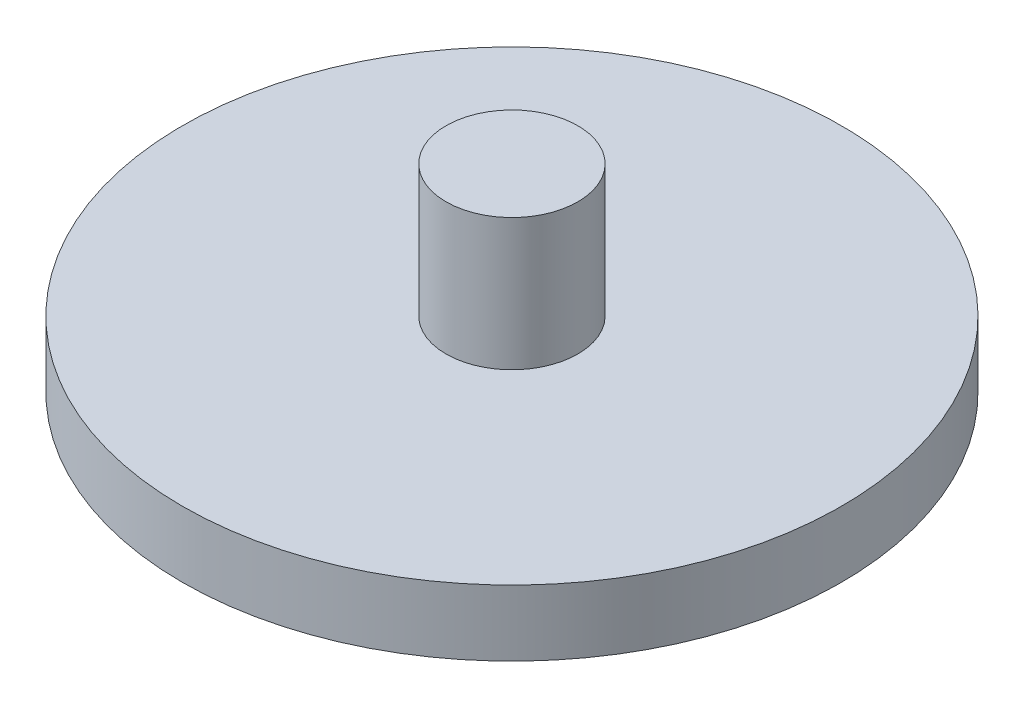
from build123d import *

# Parameters (mm, degrees)
SKETCH2_R           = 50
BOSS_EXTRUDE1_DEPTH = 10
SKETCH3_R           = 10
BOSS_EXTRUDE2_DEPTH = 20


with BuildPart() as part:
    # Sketch2 → Boss-Extrude1 (new body)
    with BuildSketch(Plane(origin=(0, 0, 0), x_dir=(1, 0, 0), z_dir=(0, 1, 0))):
        with Locations(Location((0, 0, 0), (0, 0, 270))):
            Circle(SKETCH2_R)
    extrude(amount=BOSS_EXTRUDE1_DEPTH)

    # Sketch3 → Boss-Extrude2 (add)
    with BuildSketch(Plane(origin=(0, 10, 0), x_dir=(1, 0, 0), z_dir=(0, 1, 0))):
        with Locations(Location((0, 0, 0), (0, 0, 270))):
            Circle(SKETCH3_R)
    extrude(amount=BOSS_EXTRUDE2_DEPTH)


solid = part.part
